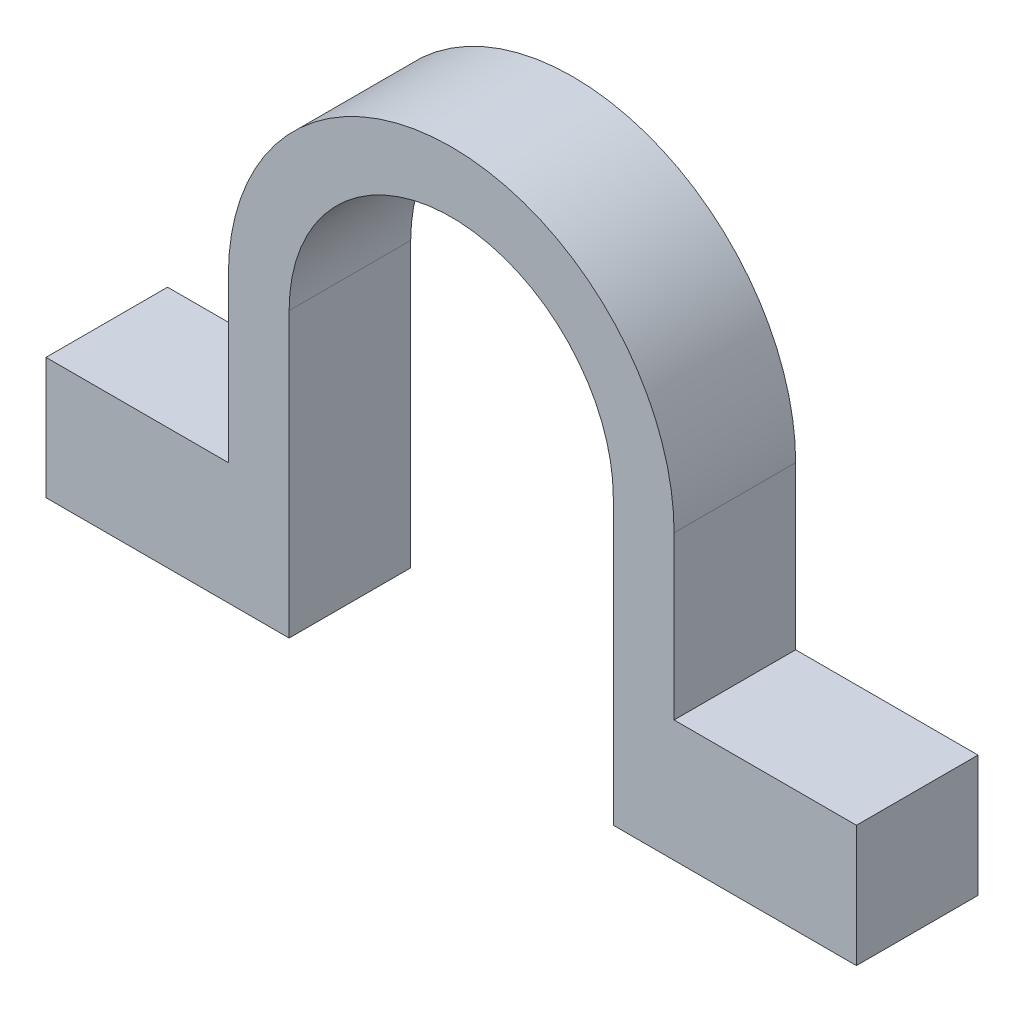
from build123d import *

# Parameters (mm, degrees)
BOSS_EXTRUDE1_DEPTH = 3


with BuildPart() as part:
    # Sketch1 → Boss-Extrude1 (new body)
    with BuildSketch(Plane.XY):
        with BuildLine():
            Line((-4, 0), (-4, -7))
            Line((-4, -7), (-10, -7))
            Line((-10, -7), (-10, -4))
            Line((-10, -4), (-5.5, -4))
            Line((-5.5, -4), (-5.5, 0))
            ThreePointArc((-5.5, 0), (0, 5.5), (5.5, 0))
            Line((5.5, 0), (5.5, -4))
            Line((5.5, -4), (10, -4))
            Line((10, -4), (10, -7))
            Line((10, -7), (4, -7))
            Line((4, -7), (4, 0))
            ThreePointArc((4, 0), (0, 4), (-4, 0))
        make_face()
    extrude(amount=BOSS_EXTRUDE1_DEPTH)


solid = part.part
